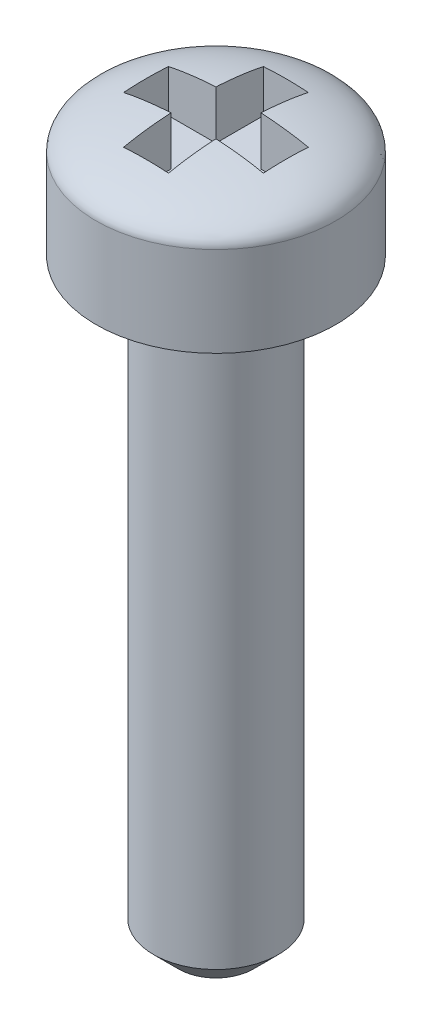
from build123d import *

# Parameters (mm, degrees)
CUT_EXTRUDE1_DEPTH = 1


with BuildPart() as part:
    # Sketch2 → Revolve1 (revolve)
    with BuildSketch(Plane.XY):
        with BuildLine():
            Line((-2.4, -2.5), (-2.4, -0.7))
            add(Edge.make_bspline(
                [(0, 0), (-2.4, 0), (-2.4, -0.7)],
                knots=[4.71238898, 4.71238898, 4.71238898, 6.283185307, 6.283185307, 6.283185307], degree=2, weights=[1, 0.707106781, 1]))
            Line((0, 0), (0, -14.5))
            Line((0, -14.5), (-0.75, -14.5))
            Line((-0.75, -14.5), (-1.25, -14))
            Line((-1.25, -14), (-1.25, -2.5))
            Line((-1.25, -2.5), (-2.4, -2.5))
        make_face()
    revolve(axis=Axis((0, 0, 0), (0, -1, 0)))

    # Sketch3 → Cut-Extrude1 (cut)
    with BuildSketch(Plane(origin=(0, 0, 0), x_dir=(1, 0, 0), z_dir=(0, 1, 0))):
        Polygon((-0.45, 1.4), (0.45, 1.4), (0.45, 0.45), (1.4, 0.45), (1.4, -0.45), (0.45, -0.45), (0.45, -1.4), (-0.45, -1.4), (-0.45, -0.45), (-1.4, -0.45), (-1.4, 0.45), (-0.45, 0.45), align=None)
    extrude(amount=-CUT_EXTRUDE1_DEPTH, mode=Mode.SUBTRACT)


solid = part.part
